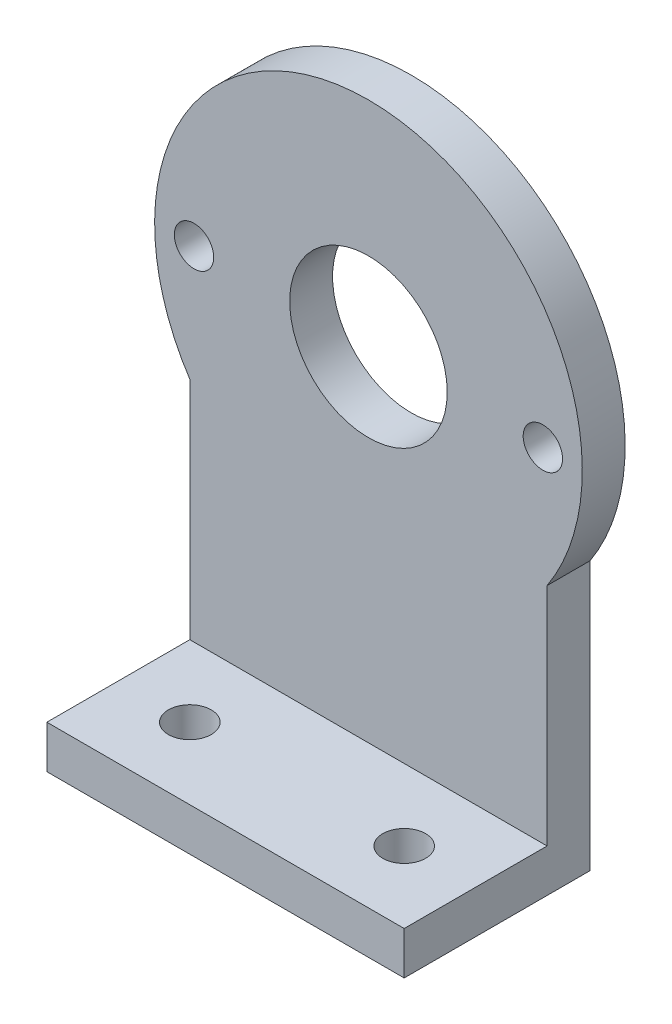
from build123d import *

# Parameters (mm, degrees)
BOSS_EXTRUDE1_DEPTH = 3.81
SKETCH3_R           = 7
CUT_EXTRUDE1_DEPTH  = 40.386802358
SKETCH4_W           = 31.75
SKETCH4_H           = 3.81
BOSS_EXTRUDE2_DEPTH = 12.7
SKETCH5_R           = 1.905
CUT_EXTRUDE2_DEPTH  = 56.514417046
SKETCH6_R           = 1.75
CUT_EXTRUDE3_DEPTH  = 42.207937342


with BuildPart() as part:
    # Sketch1 → Boss-Extrude1 (new body)
    with BuildSketch(Plane.XY):
        with BuildLine():
            ThreePointArc((19, 0), (-5.448623679, 18.201991649), (-15.875, -10.43955818))
            Line((-15.875, -10.43955818), (15.875, -10.43955818))
            ThreePointArc((15.875, -10.43955818), (18.201991649, -5.448623679), (19, 0))
        make_face()
        with BuildLine():
            ThreePointArc((15.875, -10.43955818), (0, -19), (-15.875, -10.43955818))
            Line((-15.875, -10.43955818), (-15.875, -34.29))
            Line((-15.875, -34.29), (15.875, -34.29))
            Line((15.875, -34.29), (15.875, -10.43955818))
        make_face()
        with BuildLine():
            Line((15.875, -10.43955818), (-15.875, -10.43955818))
            ThreePointArc((-15.875, -10.43955818), (0, -19), (15.875, -10.43955818))
        make_face()
    extrude(amount=BOSS_EXTRUDE1_DEPTH)

    # Sketch3 → Cut-Extrude1 (cut, through all)
    with BuildSketch(Plane.XY.offset(3.81)):
        Circle(SKETCH3_R)
    extrude(amount=-CUT_EXTRUDE1_DEPTH, mode=Mode.SUBTRACT)

    # Sketch4 → Boss-Extrude2 (add)
    with BuildSketch(Plane.XY.offset(3.81)):
        with Locations((0, -32.385)):
            Rectangle(SKETCH4_W, SKETCH4_H)
    extrude(amount=BOSS_EXTRUDE2_DEPTH)

    # Sketch5 → Cut-Extrude2 (cut, through all)
    with BuildSketch(Plane(origin=(0, -30.48, 0), x_dir=(1, 0, 0), z_dir=(0, 1, 0))):
        with Locations(Location((-9.525, -10.16, 0), (0, 0, 270))):
            Circle(SKETCH5_R)
        with Locations(Location((9.525, -10.16, 0), (0, 0, 90))):
            Circle(SKETCH5_R)
    extrude(amount=-CUT_EXTRUDE2_DEPTH, mode=Mode.SUBTRACT)

    # Sketch6 → Cut-Extrude3 (cut, through all)
    with BuildSketch(Plane.XY.offset(3.81)):
        with Locations((15.5, 0)):
            Circle(SKETCH6_R)
        with Locations((-15.5, 0)):
            Circle(SKETCH6_R)
    extrude(amount=-CUT_EXTRUDE3_DEPTH, mode=Mode.SUBTRACT)


solid = part.part
